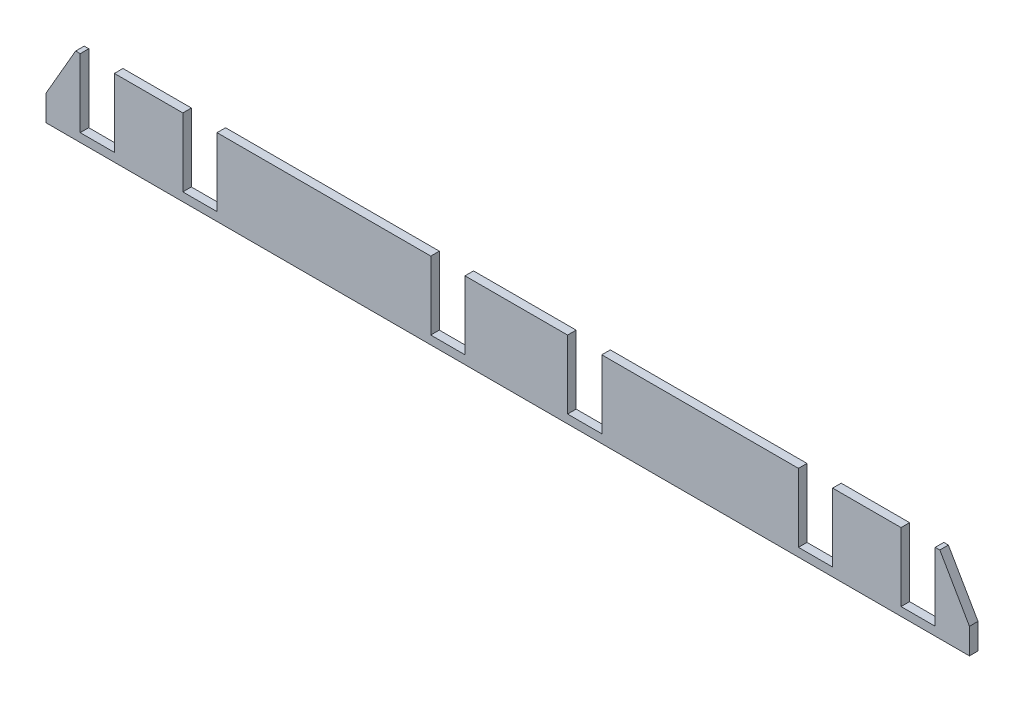
from build123d import *
from OCP.BRepFilletAPI import BRepFilletAPI_MakeChamfer

# Parameters (mm, degrees)
BOSS_EXTRU_1_DEPTH = 10
CHANFREIN1_SIZE    = 60
CHANFREIN1_SIZE2   = 34.641016151


with BuildPart() as part:
    # Esquisse1 → Boss.-Extru.1 (new body)
    with BuildSketch(Plane.XY):
        Polygon((0, 0), (1080, 0), (1080, 90), (1040, 90), (1040, 10), (1000, 10), (1000, 90), (920, 90), (920, 10), (880, 10), (880, 90), (650, 90), (650, 10), (610, 10), (610, 90), (490, 90), (490, 10), (450, 10), (450, 90), (200, 90), (200, 10), (160, 10), (160, 90), (80, 90), (80, 10), (40, 10), (40, 90), (0, 90), align=None)
    extrude(amount=BOSS_EXTRU_1_DEPTH)

    # Chanfrein1: one chamfer whose edges measure the first distance from different faces: ONE call of the kernel's chamfer builder (chamfer() names one face for all edges)
    chanfrein1_edges_1 = [part.edges().sort_by_distance(p)[0] for p in [
        (0, 90, 5),
    ]]
    chanfrein1_side_1 = [part.faces().sort_by_distance(p)[0] for p in [
        (0, 45, 5),
    ]]
    chanfrein1_edges_2 = [part.edges().sort_by_distance(p)[0] for p in [
        (1080, 90, 5),
    ]]
    chanfrein1_side_2 = [part.faces().sort_by_distance(p)[0] for p in [
        (1080, 45, 5),
    ]]
    chanfrein1 = BRepFilletAPI_MakeChamfer(part.part.solid().wrapped)
    for e in chanfrein1_edges_1:
        chanfrein1.Add(CHANFREIN1_SIZE, CHANFREIN1_SIZE2, e.wrapped, chanfrein1_side_1[0].wrapped)  # the first distance lies on this face
    for e in chanfrein1_edges_2:
        chanfrein1.Add(CHANFREIN1_SIZE, CHANFREIN1_SIZE2, e.wrapped, chanfrein1_side_2[0].wrapped)  # the first distance lies on this face
    add(Compound.cast(chanfrein1.Shape()), mode=Mode.REPLACE)


solid = part.part
